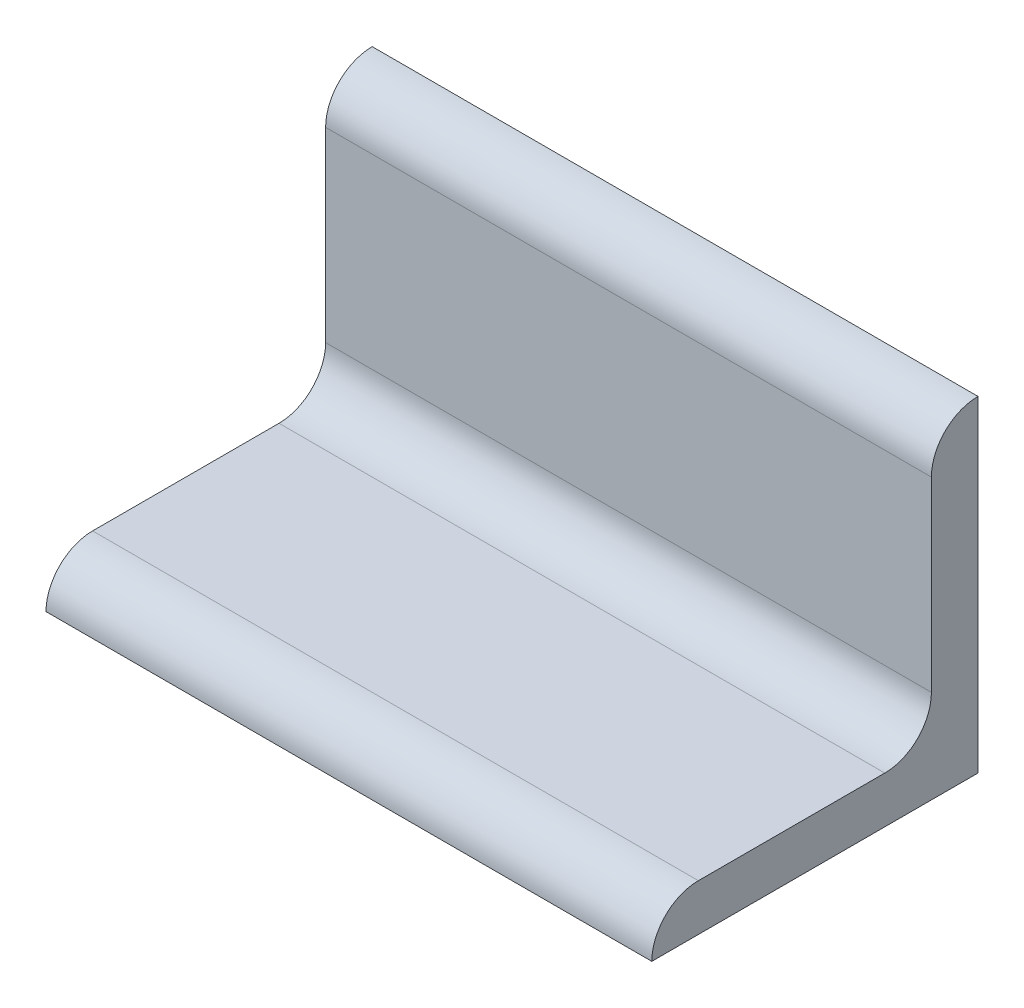
from build123d import *

# Parameters (mm, degrees)
ANGLE_IRON_35_X_35_X_5_1_DEPTH = 65


with BuildPart() as part:
    # Sketch11 → Angle iron 35 X 35 X 5(1) (new body)
    with BuildSketch(Plane.YZ.offset(-32.229166667)):
        with BuildLine():
            Line((0, 0), (0, 35))
            ThreePointArc((0, 35), (3.535533906, 33.535533906), (5, 30))
            Line((5, 30), (5, 10))
            ThreePointArc((5, 10), (6.464466094, 6.464466094), (10, 5))
            Line((10, 5), (30, 5))
            ThreePointArc((30, 5), (33.535533906, 3.535533906), (35, 0))
            Line((35, 0), (0, 0))
        make_face()
    extrude(amount=ANGLE_IRON_35_X_35_X_5_1_DEPTH)


solid = part.part
